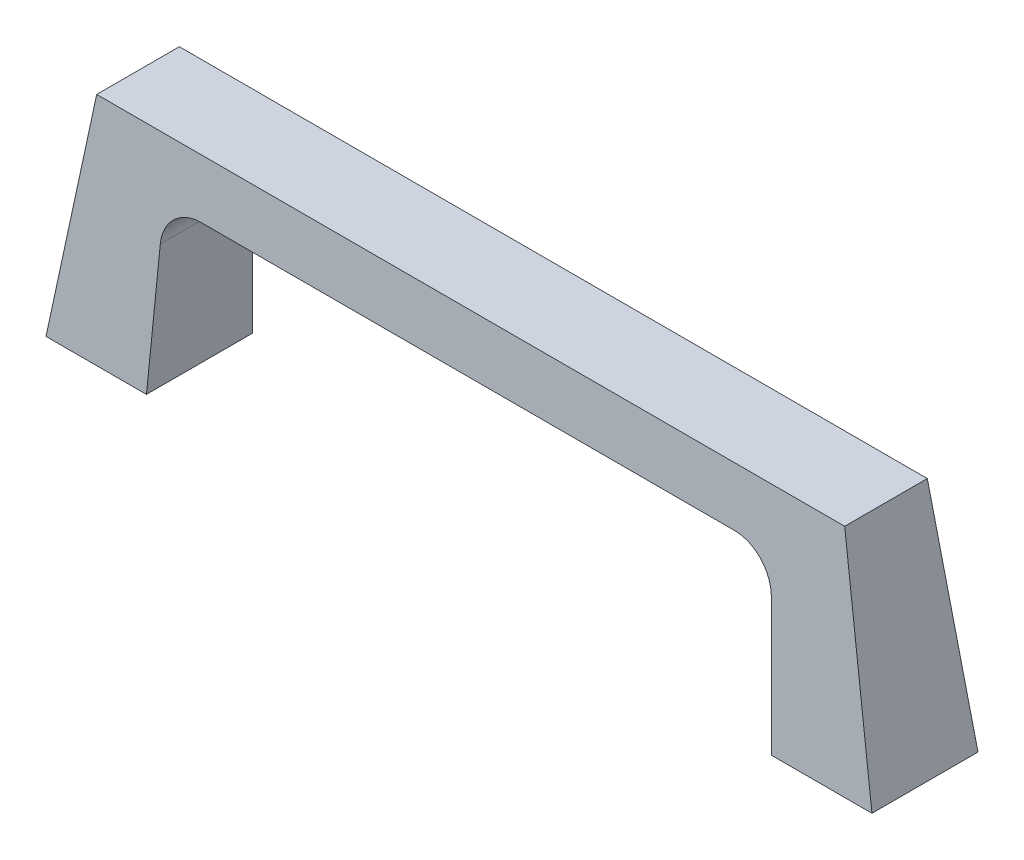
from build123d import *

# Parameters (mm, degrees)
BOSS_EXTRUDE1_DEPTH = 19
DRAFT1_ANGLE        = 3


with BuildPart() as part:
    # Sketch1 → Boss-Extrude1 (new body)
    with BuildSketch(Plane.XY):
        with BuildLine():
            Line((-74, 0), (-67.013633203, 40))
            Line((-67.013633203, 40), (67.013633203, 40))
            Line((67.013633203, 40), (74, 0))
            Line((74, 0), (56, 0))
            Line((56, 0), (54.743185165, 23.37581641))
            ThreePointArc((54.743185165, 23.37581641), (52.568324233, 28.080881561), (47.753280872, 30))
            Line((47.753280872, 30), (-47.753280872, 30))
            ThreePointArc((-47.753280872, 30), (-52.568324233, 28.080881561), (-54.743185165, 23.37581641))
            Line((-54.743185165, 23.37581641), (-56, 0))
            Line((-56, 0), (-74, 0))
        make_face()
    extrude(amount=BOSS_EXTRUDE1_DEPTH)

    # Draft1
    draft1_faces = [part.faces().sort_by_distance(p)[0] for p in [
        (-68.996577663, 19.736222921, 0),
        (-68.996577663, 19.736222921, 19),
    ]]
    draft(draft1_faces, Plane.ZX, DRAFT1_ANGLE)

    # Sketch3 → M6x1.0 Tapped Hole1 (revolve, cut)
    with BuildSketch(Plane(origin=(-65, 0, 9.5), x_dir=(0, 0, -1), z_dir=(1, 0, 0))):
        Polygon((0, 0), (0, 16.502151548), (2.5, 15), (2.5, 0), align=None)
    m6x1_0_tapped_hole1 = revolve(axis=Axis((-65, -6.35, 9.5), (0, 1, 0)), mode=Mode.SUBTRACT)

    # Mirror1: M6x1.0 Tapped Hole1 across plane
    add(m6x1_0_tapped_hole1.mirror(Plane(origin=(0, 0, 0), x_dir=(0, 0, 1), z_dir=(1, 0, 0))), mode=Mode.SUBTRACT)


solid = part.part
